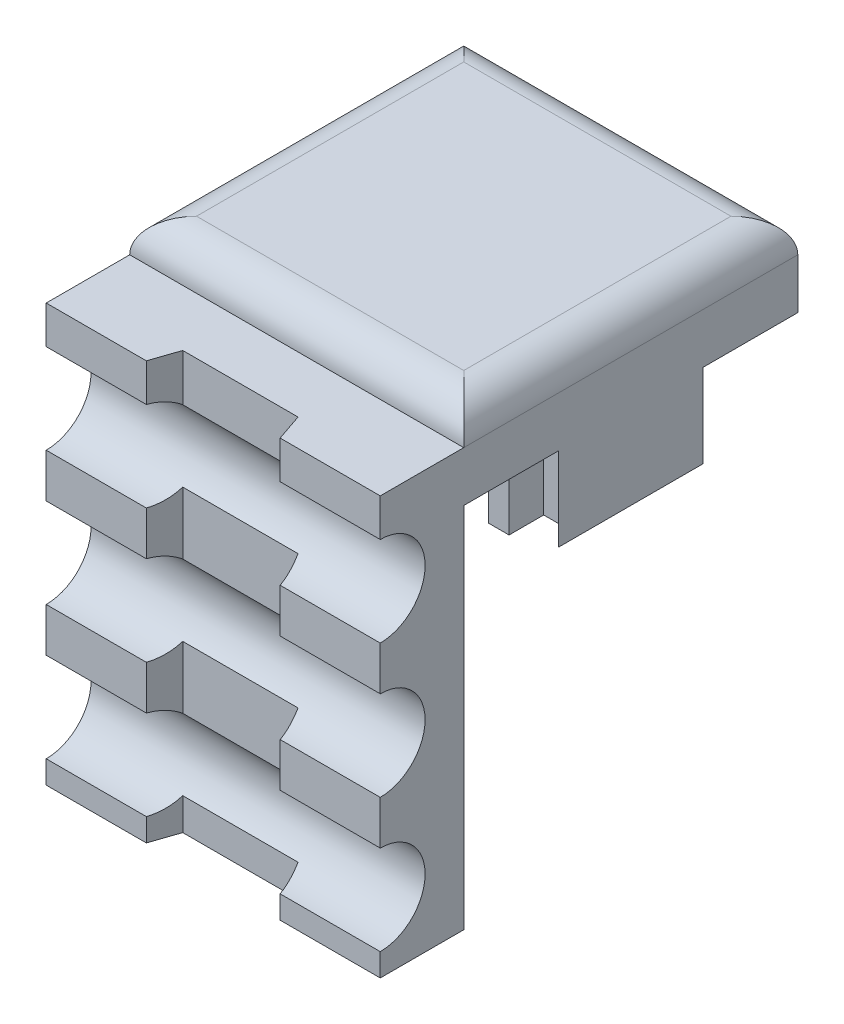
from build123d import *

# Parameters (mm, degrees)
SALIENTE_EXTRUIR1_DEPTH   = 5
SALIENTE_EXTRUIR1_2_DEPTH = 5
SALIENTE_EXTRUIR1_3_DEPTH = 5
SALIENTE_EXTRUIR1_4_DEPTH = 5
CROQUIS3_W                = 20
CROQUIS3_H                = 20
SALIENTE_EXTRUIR2_DEPTH   = 5
REDONDEO1_R               = 2
CROQUIS4_W                = 20
CROQUIS4_H                = 25
SALIENTE_EXTRUIR3_DEPTH   = 5
CORTAR_EXTRUIR1_DEPTH     = 31.822070015
CORTAR_EXTRUIR2_DEPTH     = 31.232432916


with BuildPart() as part:
    # Croquis2 → Saliente-Extruir1 (new body)
    with BuildSketch(Plane(origin=(0, 0, 0), x_dir=(1, 0, 0), z_dir=(0, 1, 0))):
        Polygon((-3.880962474, 9.7), (-4.31520152, 10), (4.31520152, 10), (3.880962474, 9.7), (3.100109842, 9.007732001), (3.100109842, 7.886854264), (5.174607071, 7.886854264), (5.174607071, 6.657084853), (2.689193029, 4.171670811), (-2.689193029, 4.171670811), (-5.174607071, 6.657084853), (-5.174607071, 7.886854264), (-3.100109842, 7.886854264), (-3.100109842, 9.007732001), align=None)
    extrude(amount=SALIENTE_EXTRUIR1_DEPTH)



with BuildPart() as body_2:
    # Croquis2 → Saliente-Extruir1 2 (new body)
    with BuildSketch(Plane(origin=(0, 0, 0), x_dir=(1, 0, 0), z_dir=(0, 1, 0))):
        Polygon((10, 4.31520152), (10, -4.31520152), (9.7, -3.880962474), (9.007732001, -3.100109842), (7.886854264, -3.100109842), (7.886854264, -5.174607071), (6.657084853, -5.174607071), (4.171670811, -2.689193029), (4.171670811, 2.689193029), (6.657084853, 5.174607071), (7.886854264, 5.174607071), (7.886854264, 3.100109842), (9.007732001, 3.100109842), (9.7, 3.880962474), align=None)
    extrude(amount=SALIENTE_EXTRUIR1_2_DEPTH)


with BuildPart() as body_3:
    # Croquis2 → Saliente-Extruir1 3 (new body)
    with BuildSketch(Plane(origin=(0, 0, 0), x_dir=(1, 0, 0), z_dir=(0, 1, 0))):
        Polygon((4.31520152, -10), (-4.31520152, -10), (-3.880962474, -9.7), (-3.100109842, -9.007732001), (-3.100109842, -7.886854264), (-5.174607071, -7.886854264), (-5.174607071, -6.657084853), (-2.689193029, -4.171670811), (2.689193029, -4.171670811), (5.174607071, -6.657084853), (5.174607071, -7.886854264), (3.100109842, -7.886854264), (3.100109842, -9.007732001), (3.880962474, -9.7), align=None)
    extrude(amount=SALIENTE_EXTRUIR1_3_DEPTH)


with BuildPart() as body_4:
    # Croquis2 → Saliente-Extruir1 4 (new body)
    with BuildSketch(Plane(origin=(0, 0, 0), x_dir=(1, 0, 0), z_dir=(0, 1, 0))):
        Polygon((-10, -4.31520152), (-10, 4.31520152), (-9.7, 3.880962474), (-9.007732001, 3.100109842), (-7.886854264, 3.100109842), (-7.886854264, 5.174607071), (-6.657084853, 5.174607071), (-4.171670811, 2.689193029), (-4.171670811, -2.689193029), (-6.657084853, -5.174607071), (-7.886854264, -5.174607071), (-7.886854264, -3.100109842), (-9.007732001, -3.100109842), (-9.7, -3.880962474), align=None)
    extrude(amount=SALIENTE_EXTRUIR1_4_DEPTH)


with BuildPart() as part_1:
    add(part.part)

    add(body_2.part)  # Saliente-Extruir2 merges body 2

    add(body_3.part)  # Saliente-Extruir2 merges body 3

    add(body_4.part)  # Saliente-Extruir2 merges body 4
    # Croquis3 → Saliente-Extruir2 (add)
    with BuildSketch(Plane(origin=(0, 5, 0), x_dir=(1, 0, 0), z_dir=(0, 1, 0))):
        Rectangle(CROQUIS3_W, CROQUIS3_H)
    extrude(amount=SALIENTE_EXTRUIR2_DEPTH)

    # Redondeo1
    redondeo1_edges = [part_1.edges().sort_by_distance(p)[0] for p in [
        (10, 10, 0),
        (0, 10, -10),
        (-10, 10, 0),
        (0, 10, 10),
    ]]
    fillet(redondeo1_edges, radius=REDONDEO1_R)

    # Croquis4 → Saliente-Extruir3 (add)
    with BuildSketch(Plane.XY.offset(10)):
        with Locations((0, -4.5)):
            Rectangle(CROQUIS4_W, CROQUIS4_H)
    extrude(amount=SALIENTE_EXTRUIR3_DEPTH)

    # Croquis5 → Cortar-Extruir1 (cut, through all)
    with BuildSketch(Plane(origin=(0, 8, 0), x_dir=(1, 0, 0), z_dir=(0, 1, 0))):
        Polygon((4.006067099, -15), (-4.006067099, -15), (-3.450123093, -13.373585697), (3.450123093, -13.373585697), align=None)
    extrude(amount=-CORTAR_EXTRUIR1_DEPTH, mode=Mode.SUBTRACT)

    # Croquis6 → Cortar-Extruir2 (cut, through all)
    with BuildSketch(Plane(origin=(10, 0, 0), x_dir=(0, 0, -1), z_dir=(1, 0, 0))):
        with BuildLine():
            Line((-15, 5.73584659), (-15, 0.367400389))
            ThreePointArc((-15, 0.367400389), (-12.315776899, 3.051623489), (-15, 5.73584659))
        make_face()
        with BuildLine():
            Line((-15, -2.26415341), (-15, -7.632599611))
            ThreePointArc((-15, -7.632599611), (-12.315776899, -4.948376511), (-15, -2.26415341))
        make_face()
        with BuildLine():
            Line((-15, -10.26415341), (-15, -15.632599611))
            ThreePointArc((-15, -15.632599611), (-12.315776899, -12.948376511), (-15, -10.26415341))
        make_face()
    extrude(amount=-CORTAR_EXTRUIR2_DEPTH, mode=Mode.SUBTRACT)


solid = part_1.part
